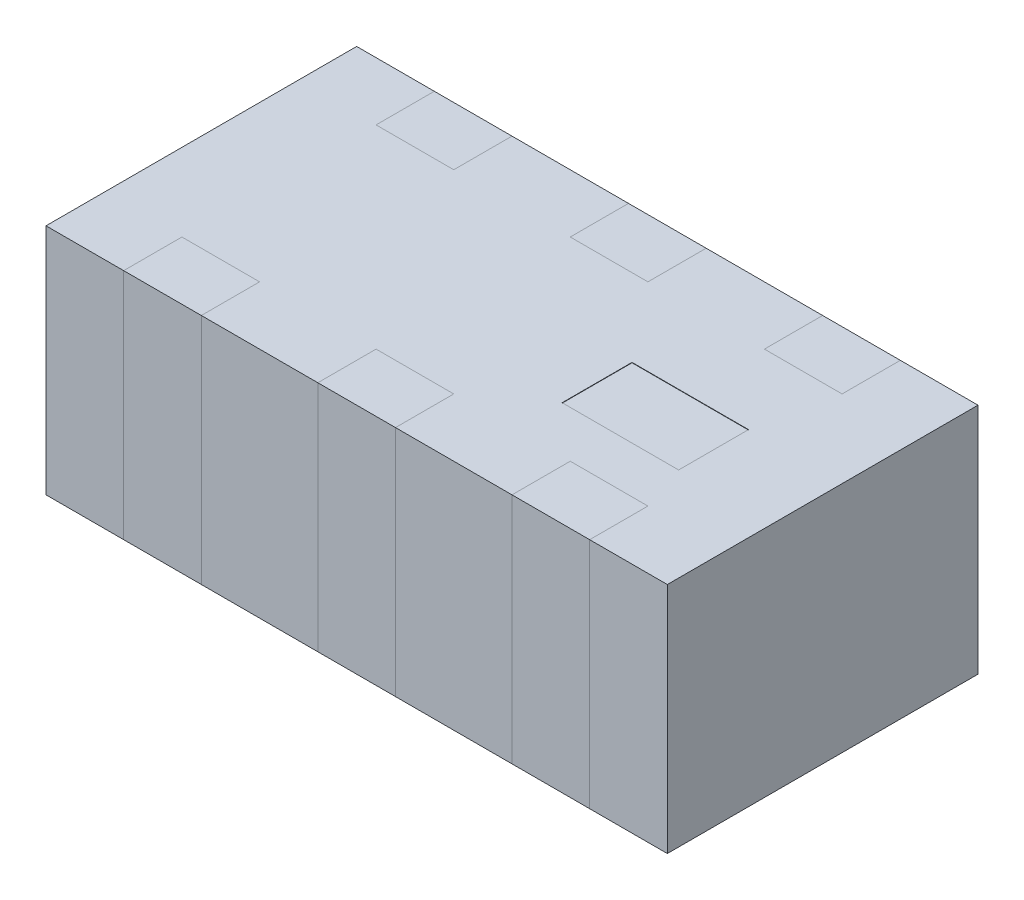
from build123d import *

# Parameters (mm, degrees)
SKETCH1_W             = 1.6
SKETCH1_H             = 0.8
BOSS_EXTRUDE1_DEPTH   = 0.6
SKETCH2_W             = 0.2
SKETCH2_H             = 0.15
CUT_EXTRUDE1_DEPTH    = 1
SKETCH3_W             = 0.2
SKETCH3_H             = 0.15
BOSS_EXTRUDE3_DEPTH   = 0.6
BOSS_EXTRUDE3_2_DEPTH = 0.6
BOSS_EXTRUDE3_3_DEPTH = 0.6
BOSS_EXTRUDE3_4_DEPTH = 0.6
BOSS_EXTRUDE3_5_DEPTH = 0.6
BOSS_EXTRUDE3_6_DEPTH = 0.6
SKETCH4_W             = 0.3
SKETCH4_H             = 0.18
CUT_EXTRUDE2_DEPTH    = 0.001


with BuildPart() as part:
    # Sketch1 → Boss-Extrude1 (new body)
    with BuildSketch(Plane(origin=(0, 0, 0), x_dir=(1, 0, 0), z_dir=(0, 1, 0))):
        Rectangle(SKETCH1_W, SKETCH1_H)
    extrude(amount=BOSS_EXTRUDE1_DEPTH)

    # Sketch2 → Cut-Extrude1 (cut)
    with BuildSketch(Plane(origin=(0, 0.6, 0), x_dir=(1, 0, 0), z_dir=(0, 1, 0))):
        with Locations((0.5, -0.325)):
            Rectangle(SKETCH2_W, SKETCH2_H)
        with Locations((0, -0.325)):
            Rectangle(SKETCH2_W, SKETCH2_H)
        with Locations((-0.5, -0.325)):
            Rectangle(SKETCH2_W, SKETCH2_H)
        with Locations((0, 0.325)):
            Rectangle(SKETCH2_W, SKETCH2_H)
        with Locations((0.5, 0.325)):
            Rectangle(SKETCH2_W, SKETCH2_H)
        with Locations((-0.5, 0.325)):
            Rectangle(SKETCH2_W, SKETCH2_H)
    extrude(amount=-CUT_EXTRUDE1_DEPTH, mode=Mode.SUBTRACT)

    # Sketch4 → Cut-Extrude2 (cut)
    with BuildSketch(Plane(origin=(0, 0.6, 0), x_dir=(1, 0, 0), z_dir=(0, 1, 0))):
        with Locations((0.409078339, -0.04)):
            Rectangle(SKETCH4_W, SKETCH4_H)
    extrude(amount=-CUT_EXTRUDE2_DEPTH, mode=Mode.SUBTRACT)


with BuildPart() as body_2:
    # Sketch3 → Boss-Extrude3 (new body)
    with BuildSketch(Plane(origin=(0, 0.6, 0), x_dir=(1, 0, 0), z_dir=(0, 1, 0))):
        with Locations((-0.5, 0.325)):
            Rectangle(SKETCH3_W, SKETCH3_H)
    extrude(amount=-BOSS_EXTRUDE3_DEPTH)


with BuildPart() as body_3:
    # Sketch3 → Boss-Extrude3 2 (new body)
    with BuildSketch(Plane(origin=(0, 0.6, 0), x_dir=(1, 0, 0), z_dir=(0, 1, 0))):
        with Locations((0.5, -0.325)):
            Rectangle(SKETCH3_W, SKETCH3_H)
    extrude(amount=-BOSS_EXTRUDE3_2_DEPTH)


with BuildPart() as body_4:
    # Sketch3 → Boss-Extrude3 3 (new body)
    with BuildSketch(Plane(origin=(0, 0.6, 0), x_dir=(1, 0, 0), z_dir=(0, 1, 0))):
        with Locations((-0.5, -0.325)):
            Rectangle(SKETCH3_W, SKETCH3_H)
    extrude(amount=-BOSS_EXTRUDE3_3_DEPTH)


with BuildPart() as body_5:
    # Sketch3 → Boss-Extrude3 4 (new body)
    with BuildSketch(Plane(origin=(0, 0.6, 0), x_dir=(1, 0, 0), z_dir=(0, 1, 0))):
        with Locations((0, -0.325)):
            Rectangle(SKETCH3_W, SKETCH3_H)
    extrude(amount=-BOSS_EXTRUDE3_4_DEPTH)


with BuildPart() as body_6:
    # Sketch3 → Boss-Extrude3 5 (new body)
    with BuildSketch(Plane(origin=(0, 0.6, 0), x_dir=(1, 0, 0), z_dir=(0, 1, 0))):
        with Locations((0.5, 0.325)):
            Rectangle(SKETCH3_W, SKETCH3_H)
    extrude(amount=-BOSS_EXTRUDE3_5_DEPTH)


with BuildPart() as body_7:
    # Sketch3 → Boss-Extrude3 6 (new body)
    with BuildSketch(Plane(origin=(0, 0.6, 0), x_dir=(1, 0, 0), z_dir=(0, 1, 0))):
        with Locations((0, 0.325)):
            Rectangle(SKETCH3_W, SKETCH3_H)
    extrude(amount=-BOSS_EXTRUDE3_6_DEPTH)


solid = Compound([part.part, body_2.part, body_3.part, body_4.part, body_5.part, body_6.part, body_7.part])
